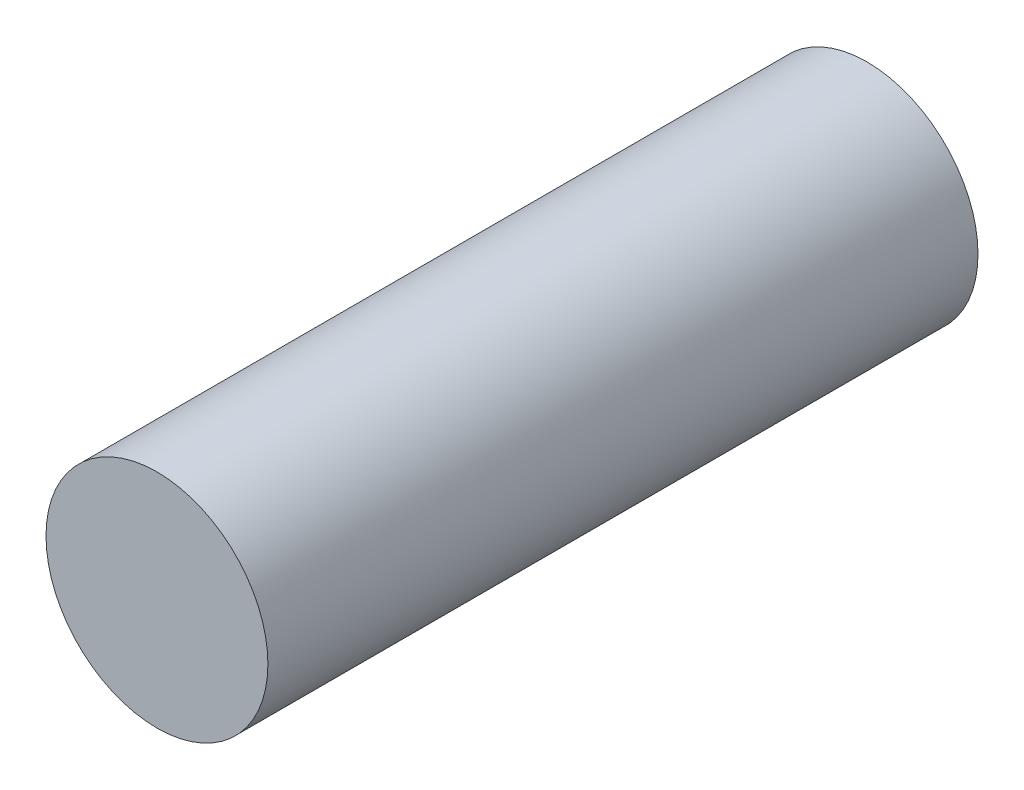
from build123d import *

# Parameters (mm, degrees)
ESQUISSE1_R        = 12.5
BOSS_EXTRU_1_DEPTH = 80


with BuildPart() as part:
    # Esquisse1 → Boss.-Extru.1 (new body)
    with BuildSketch(Plane.XY):
        Circle(ESQUISSE1_R)
    extrude(amount=BOSS_EXTRU_1_DEPTH)


solid = part.part
